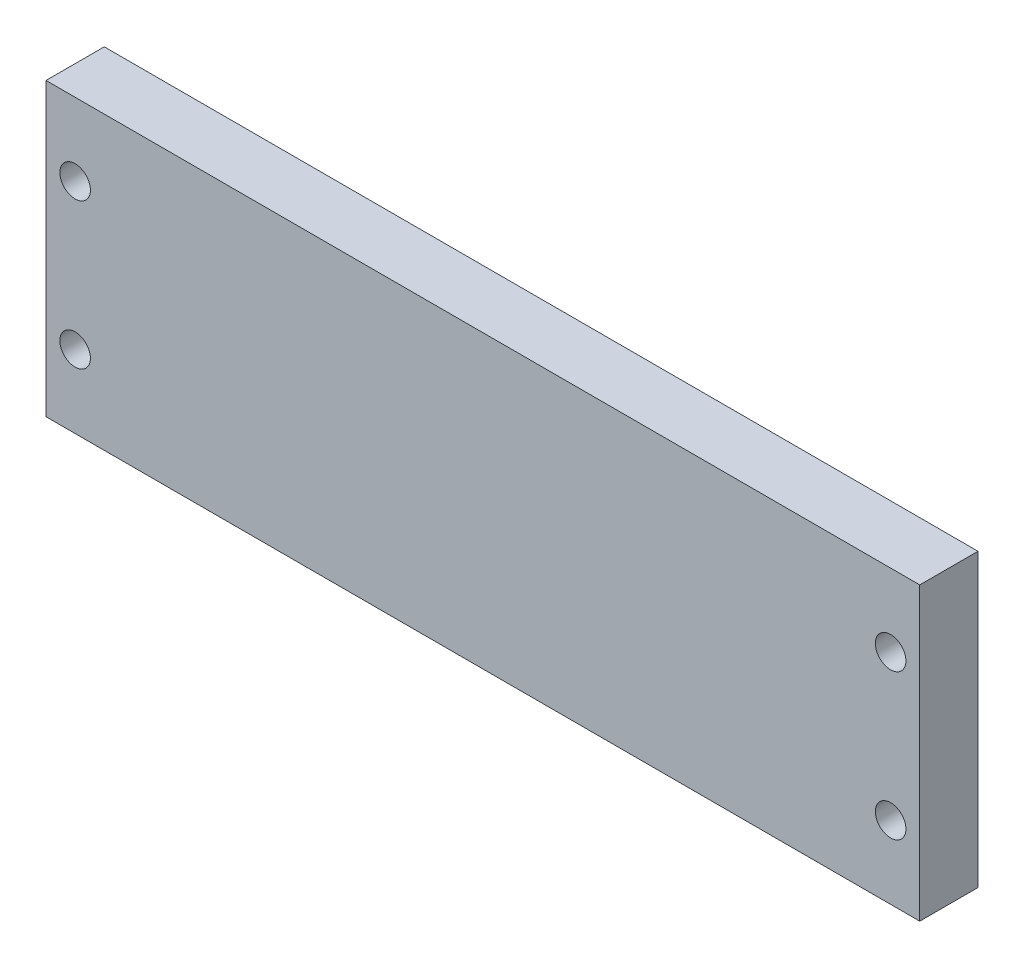
from build123d import *

# Parameters (mm, degrees)
SKETCH_1_W             = 120
SKETCH_1_H             = 40
EXTRUDE_1_DEPTH        = 8
SKETCH_2_R             = 2.1
CUT_EXTRUDE_1_DEPTH    = 50
PATTERN_LINEAR_2_COUNT = 2
PATTERN_LINEAR_2_PITCH = 112
SKETCH_3_R             = 3.55
CUT_EXTRUDE_2_DEPTH    = 5


with BuildPart() as part:
    # Эскиз1 → Бобышка-Вытянуть1 (new body)
    with BuildSketch(Plane.XY):
        Rectangle(SKETCH_1_W, SKETCH_1_H)
    extrude(amount=EXTRUDE_1_DEPTH)

    # Эскиз2 → Вырез-Вытянуть1 (cut)
    with BuildSketch(Plane.XY.offset(8)):
        with Locations((-56, 10)):
            Circle(SKETCH_2_R)
        with Locations((-56, -10)):
            Circle(SKETCH_2_R)
    cut_extrude_1 = extrude(amount=-CUT_EXTRUDE_1_DEPTH, mode=Mode.SUBTRACT)

    # Линейный массив2: Вырез-Вытянуть1 ×2
    with Locations(*[(i * PATTERN_LINEAR_2_PITCH, 0, 0) for i in range(1, PATTERN_LINEAR_2_COUNT)]):
        add(cut_extrude_1, mode=Mode.SUBTRACT)

    # Эскиз3 → Вырез-Вытянуть2 (cut)
    with BuildSketch(Plane(origin=(0, 0, 0), x_dir=(-1, 0, 0), z_dir=(0, 0, -1))):
        with Locations((-56, 10)):
            Circle(SKETCH_3_R)
        with Locations((-56, -10)):
            Circle(SKETCH_3_R)
        with Locations((56, 10)):
            Circle(SKETCH_3_R)
        with Locations((56, -10)):
            Circle(SKETCH_3_R)
    extrude(amount=-CUT_EXTRUDE_2_DEPTH, mode=Mode.SUBTRACT)


solid = part.part
